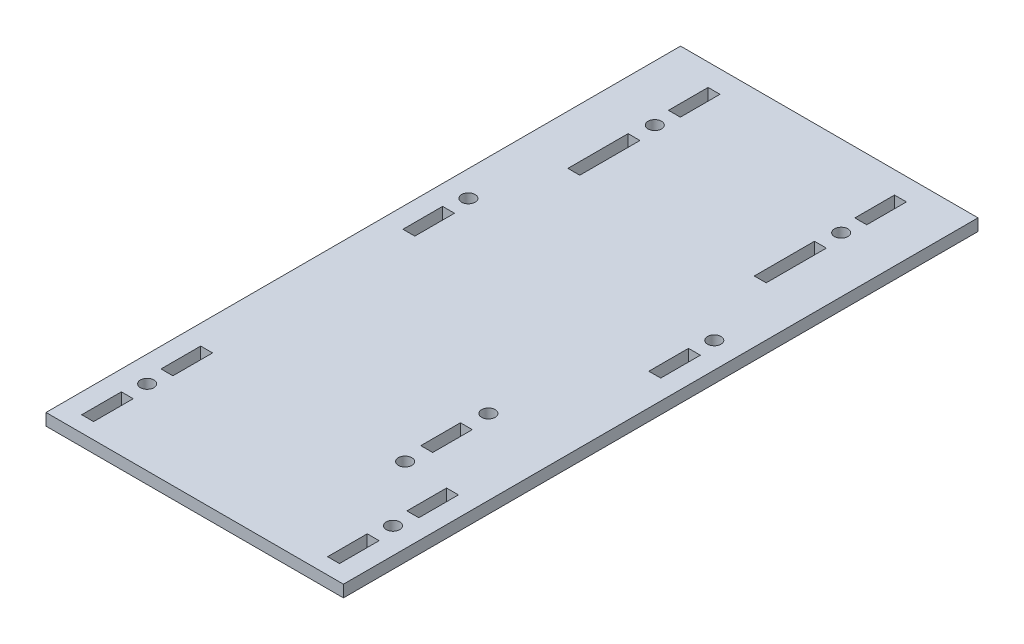
from build123d import *

# Parameters (mm, degrees)
SKETCH1_W                = 75
SKETCH1_H                = 160
BOSS_EXTRUDE1_DEPTH      = 3
M3_CLEARANCE_HOLE1_D     = 3.4
M3_CLEARANCE_HOLE1_DEPTH = 3
M3_CLEARANCE_HOLE1_TIP   = 1.021463052
SKETCH6_W                = 3
SKETCH6_H                = 10
SKETCH6_H_2              = 15.175339059
CUT_EXTRUDE3_DEPTH       = 10
SKETCH7_W                = 3
SKETCH7_H                = 10
CUT_EXTRUDE4_DEPTH       = 10


with BuildPart() as part:
    # Sketch1 → Boss-Extrude1 (new body)
    with BuildSketch(Plane(origin=(0, 0, 0), x_dir=(1, 0, 0), z_dir=(0, 1, 0))):
        with Locations((37.5, 80)):
            Rectangle(SKETCH1_W, SKETCH1_H)
    extrude(amount=BOSS_EXTRUDE1_DEPTH)

    # M3 Clearance Hole1
    with Locations(Plane(origin=(0, 0, 0), x_dir=(-1, 0, 0), z_dir=(0, -1, 0))):
        with Locations((-68.5, 19), (-56, 55.55), (-56, 34.55), (-6.5, 19), (-61, 139.5), (-14, 139.5), (-6.5, 100), (-68.5, 100)):
            Hole(M3_CLEARANCE_HOLE1_D / 2, depth=M3_CLEARANCE_HOLE1_DEPTH)
            with Locations((0, 0, -(M3_CLEARANCE_HOLE1_DEPTH + M3_CLEARANCE_HOLE1_TIP / 2))):  # 118° drill point
                Cone(0, M3_CLEARANCE_HOLE1_D / 2, M3_CLEARANCE_HOLE1_TIP, mode=Mode.SUBTRACT)

    # Sketch6 → Cut-Extrude3 (cut)
    with BuildSketch(Plane.XZ):
        with Locations((61, -149.447708573)):
            Rectangle(SKETCH6_W, SKETCH6_H)
        with Locations((61, -126.680039044)):
            Rectangle(SKETCH6_W, SKETCH6_H_2)
        with Locations((14, -149.447708573)):
            Rectangle(SKETCH6_W, SKETCH6_H)
        with Locations((14, -126.680039044)):
            Rectangle(SKETCH6_W, SKETCH6_H_2)
    extrude(amount=-CUT_EXTRUDE3_DEPTH, mode=Mode.SUBTRACT)

    # Sketch7 → Cut-Extrude4 (cut)
    with BuildSketch(Plane.XZ):
        with Locations((6.5, -9)):
            Rectangle(SKETCH7_W, SKETCH7_H)
        with Locations((6.5, -29)):
            Rectangle(SKETCH7_W, SKETCH7_H)
        with Locations((68.5, -29)):
            Rectangle(SKETCH7_W, SKETCH7_H)
        with Locations((68.5, -9)):
            Rectangle(SKETCH7_W, SKETCH7_H)
        with Locations((56, -45)):
            Rectangle(SKETCH7_W, SKETCH7_H)
        with Locations((6.5, -90)):
            Rectangle(SKETCH7_W, SKETCH7_H)
        with Locations((68.5, -90)):
            Rectangle(SKETCH7_W, SKETCH7_H)
    extrude(amount=-CUT_EXTRUDE4_DEPTH, mode=Mode.SUBTRACT)


solid = part.part
